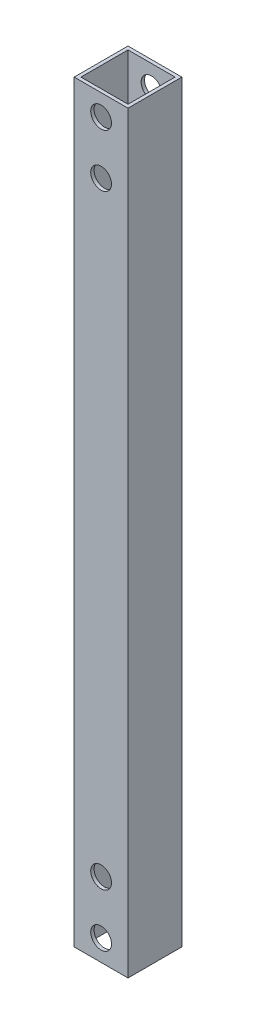
from build123d import *

# Parameters (mm, degrees)
SKETCH1_W               = 25.4
SKETCH1_H               = 25.4
SKETCH1_W_2             = 22.225
SKETCH1_H_2             = 22.225
EXTRUDE_THIN1_DEPTH     = 355.6
F_3_8_CLEARANCE_HOLE1_D = 9.8044


with BuildPart() as part:
    # Sketch1 → Extrude-Thin1 (new body)
    with BuildSketch(Plane(origin=(0, 0, 0), x_dir=(1, 0, 0), z_dir=(0, 1, 0))):
        Rectangle(SKETCH1_W, SKETCH1_H)
        Rectangle(SKETCH1_W_2, SKETCH1_H_2, mode=Mode.SUBTRACT)
    extrude(amount=EXTRUDE_THIN1_DEPTH)

    # 3/8 Clearance Hole1 (through all)
    with Locations(Plane(origin=(0, 0, -12.7), x_dir=(-1, 0, 0), z_dir=(0, 0, -1))):
        with Locations((0, 345.6), (0, 320.6), (0, 35), (0, 10)):
            Hole(F_3_8_CLEARANCE_HOLE1_D / 2)


solid = part.part
